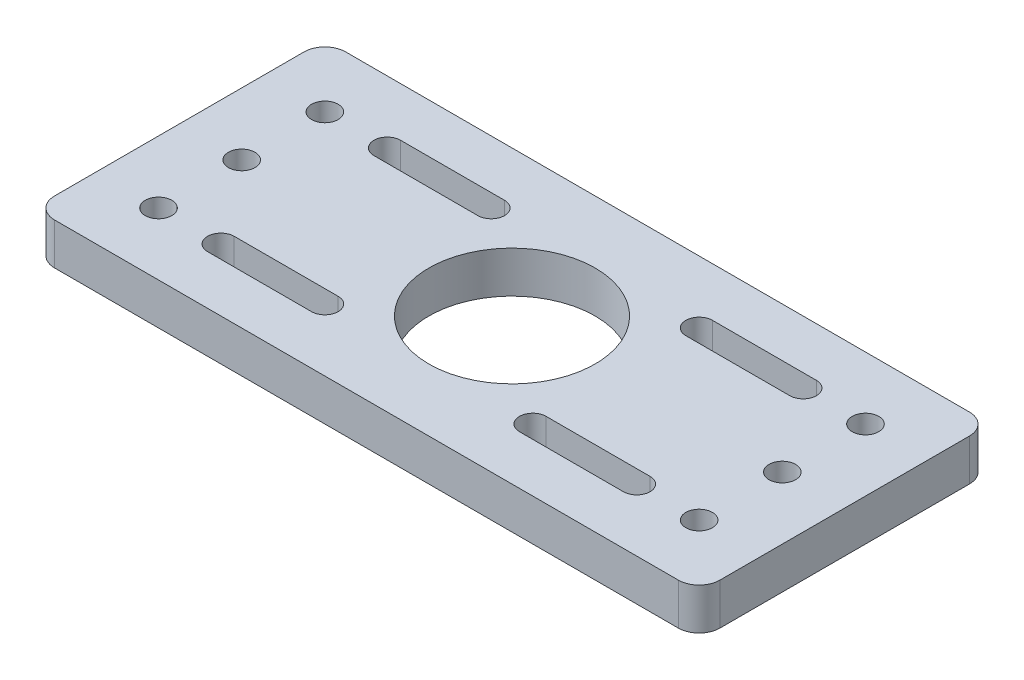
from build123d import *

# Parameters (mm, degrees)
SKETCH1_W           = 203.2
SKETCH1_H           = 88.9
SKETCH1_R           = 25.4
SKETCH1_R_2         = 4.064
BOSS_EXTRUDE1_DEPTH = 12.7
FILLET1_R           = 6.35


with BuildPart() as part:
    # Sketch1 → Boss-Extrude1 (new body)
    with BuildSketch(Plane(origin=(0, 0, 0), x_dir=(1, 0, 0), z_dir=(0, 1, 0))):
        with Locations((101.6, 44.45)):
            Rectangle(SKETCH1_W, SKETCH1_H)
        with Locations(Location((101.6, 44.45, 0), (0, 0, 270))):
            Circle(SKETCH1_R, mode=Mode.SUBTRACT)
        with Locations(Location((19.05, 19.05, 0), (0, 0, 270))):
            Circle(SKETCH1_R_2, mode=Mode.SUBTRACT)
        with Locations(Location((19.05, 44.45, 0), (0, 0, 270))):
            Circle(SKETCH1_R_2, mode=Mode.SUBTRACT)
        with Locations(Location((19.05, 69.85, 0), (0, 0, 270))):
            Circle(SKETCH1_R_2, mode=Mode.SUBTRACT)
        with Locations(Location((184.15, 69.85, 0), (0, 0, 90))):
            Circle(SKETCH1_R_2, mode=Mode.SUBTRACT)
        with Locations(Location((184.15, 44.45, 0), (0, 0, 90))):
            Circle(SKETCH1_R_2, mode=Mode.SUBTRACT)
        with Locations(Location((184.15, 19.05, 0), (0, 0, 90))):
            Circle(SKETCH1_R_2, mode=Mode.SUBTRACT)
        with BuildLine():
            Line((38.1, 73.914), (69.85, 73.914))
            ThreePointArc((69.85, 73.914), (73.914, 69.85), (69.85, 65.786))
            Line((69.85, 65.786), (38.1, 65.786))
            ThreePointArc((38.1, 65.786), (34.036, 69.85), (38.1, 73.914))
        make_face(mode=Mode.SUBTRACT)
        with BuildLine():
            Line((38.1, 14.986), (69.85, 14.986))
            ThreePointArc((69.85, 14.986), (73.914, 19.05), (69.85, 23.114))
            Line((69.85, 23.114), (38.1, 23.114))
            ThreePointArc((38.1, 23.114), (34.036, 19.05), (38.1, 14.986))
        make_face(mode=Mode.SUBTRACT)
        with BuildLine():
            Line((165.1, 14.986), (133.35, 14.986))
            ThreePointArc((133.35, 14.986), (129.286, 19.05), (133.35, 23.114))
            Line((133.35, 23.114), (165.1, 23.114))
            ThreePointArc((165.1, 23.114), (169.164, 19.05), (165.1, 14.986))
        make_face(mode=Mode.SUBTRACT)
        with BuildLine():
            Line((165.1, 73.914), (133.35, 73.914))
            ThreePointArc((133.35, 73.914), (129.286, 69.85), (133.35, 65.786))
            Line((133.35, 65.786), (165.1, 65.786))
            ThreePointArc((165.1, 65.786), (169.164, 69.85), (165.1, 73.914))
        make_face(mode=Mode.SUBTRACT)
    extrude(amount=BOSS_EXTRUDE1_DEPTH)

    # Fillet1
    fillet1_edges = [part.edges().sort_by_distance(p)[0] for p in [
        (0, 6.35, -88.9),
        (203.2, 6.35, -88.9),
        (203.2, 6.35, 0),
        (0, 6.35, 0),
    ]]
    fillet(fillet1_edges, radius=FILLET1_R)


solid = part.part
